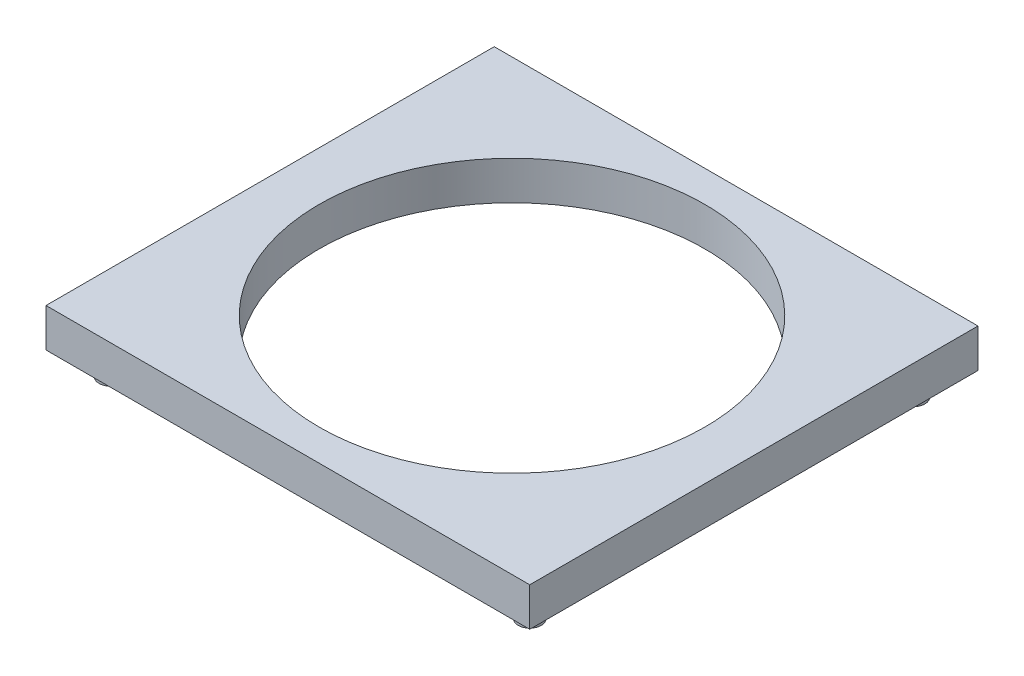
from build123d import *

# Parameters (mm, degrees)
SKETCH1_W           = 62.7
SKETCH1_H           = 58.1
SKETCH1_R           = 25
BOSS_EXTRUDE1_DEPTH = 5
SKETCH2_R           = 1.5
BOSS_EXTRUDE2_DEPTH = 3


with BuildPart() as part:
    # Sketch1 → Boss-Extrude1 (new body)
    with BuildSketch(Plane(origin=(0, 0, 0), x_dir=(1, 0, 0), z_dir=(0, 1, 0))):
        Rectangle(SKETCH1_W, SKETCH1_H)
        with Locations(Location((0, 0, 0), (0, 0, 270))):
            Circle(SKETCH1_R, mode=Mode.SUBTRACT)
    extrude(amount=BOSS_EXTRUDE1_DEPTH)

    # Sketch2 → Boss-Extrude2 (add)
    with BuildSketch(Plane.XZ):
        with Locations(Location((-27.163407974, 24.863407974, 0), (0, 0, 270))):
            Circle(SKETCH2_R)
        with Locations(Location((27.163407974, 24.863407974, 0), (0, 0, 90))):
            Circle(SKETCH2_R)
        with Locations(Location((27.163407974, -24.863407974, 0), (0, 0, 270))):
            Circle(SKETCH2_R)
        with Locations(Location((-27.163407974, -24.863407974, 0), (0, 0, 90))):
            Circle(SKETCH2_R)
    extrude(amount=BOSS_EXTRUDE2_DEPTH)


solid = part.part
